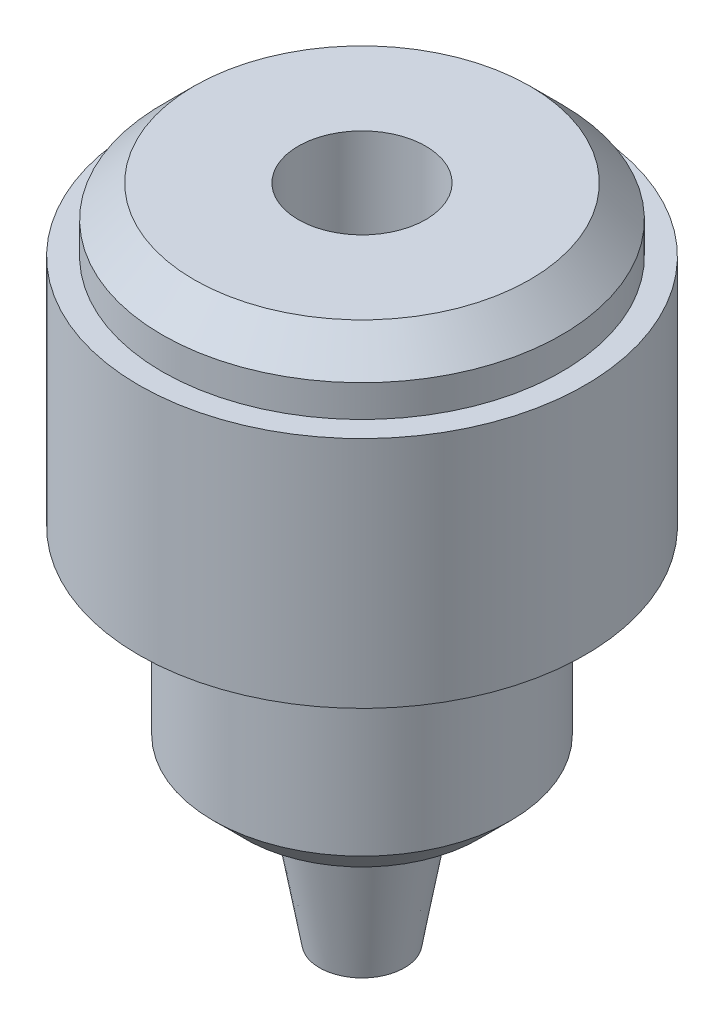
from build123d import *

# Parameters (mm, degrees)
SKETCH_1_R          = 10.5
EXTRUDE_1_DEPTH     = 28
SKETCH_4_R          = 9.4
EXTRUDE_3_DEPTH     = 3
CHAMFER_2_SIZE      = 1.5
SKETCH_5_R          = 3
CUT_EXTRUDE_2_DEPTH = 14
CUT_EXTRUDE_START   = -17
SKETCH_6_R          = 10.5
SKETCH_6_R_2        = 7
CUT_EXTRUDE_3_DEPTH = 17
CUT_EXTRUDE_START_2 = -7
SKETCH_7_R          = 7
SKETCH_7_R_2        = 2
CUT_EXTRUDE_4_DEPTH = 7
CHAMFER_3_SIZE      = 1.5
DRAFT_3_ANGLE       = 10


with BuildPart() as part:
    # Эскиз1 → Бобышка-Вытянуть1 (new body)
    with BuildSketch(Plane(origin=(0, 0, 0), x_dir=(1, 0, 0), z_dir=(0, 1, 0))):
        with Locations(Location((0, 0, 0), (0, 0, 270))):
            Circle(SKETCH_1_R)
    extrude(amount=-EXTRUDE_1_DEPTH)

    # Эскиз4 → Бобышка-Вытянуть3 (add)
    with BuildSketch(Plane(origin=(0, 0, 0), x_dir=(1, 0, 0), z_dir=(0, 1, 0))):
        with Locations(Location((0, 0, 0), (0, 0, 270))):
            Circle(SKETCH_4_R)
    extrude(amount=EXTRUDE_3_DEPTH)

    # Фаска2
    chamfer_2_edges = [part.edges().sort_by_distance(p)[0] for p in [
        (0, 3, -9.4),
    ]]
    chamfer(chamfer_2_edges, length=CHAMFER_2_SIZE)

    # Эскиз5 → Вырез-Вытянуть2 (cut)
    with BuildSketch(Plane(origin=(0, 3, 0), x_dir=(1, 0, 0), z_dir=(0, 1, 0))):
        with Locations(Location((0, 0, 0), (0, 0, 270))):
            Circle(SKETCH_5_R)
    extrude(amount=-CUT_EXTRUDE_2_DEPTH, mode=Mode.SUBTRACT)

    # Эскиз6 → Вырез-Вытянуть3 (cut)
    with BuildSketch(Plane.XZ.offset(28).offset(CUT_EXTRUDE_START)):
        with Locations(Location((0, 0, 0), (0, 0, 90))):
            Circle(SKETCH_6_R)
        with Locations(Location((0, 0, 0), (0, 0, 270))):
            Circle(SKETCH_6_R_2, mode=Mode.SUBTRACT)
    extrude(amount=CUT_EXTRUDE_3_DEPTH, mode=Mode.SUBTRACT)

    # Эскиз7 → Вырез-Вытянуть4 (cut)
    with BuildSketch(Plane.XZ.offset(28).offset(CUT_EXTRUDE_START_2)):
        with Locations(Location((0, 0, 0), (0, 0, 270))):
            Circle(SKETCH_7_R)
        with Locations(Location((0, 0, 0), (0, 0, 270))):
            Circle(SKETCH_7_R_2, mode=Mode.SUBTRACT)
    extrude(amount=CUT_EXTRUDE_4_DEPTH, mode=Mode.SUBTRACT)

    # Фаска3
    chamfer_3_edges = [part.edges().sort_by_distance(p)[0] for p in [
        (0, -21, 7),
    ]]
    chamfer(chamfer_3_edges, length=CHAMFER_3_SIZE)

    # Уклон3
    draft_3_faces = [part.faces().sort_by_distance(p)[0] for p in [
        (0, -24.5, 2),
    ]]
    draft(draft_3_faces, Plane(origin=(0, -28, 0), x_dir=(0, 0, -1), z_dir=(0, -1, 0)), DRAFT_3_ANGLE)


solid = part.part
